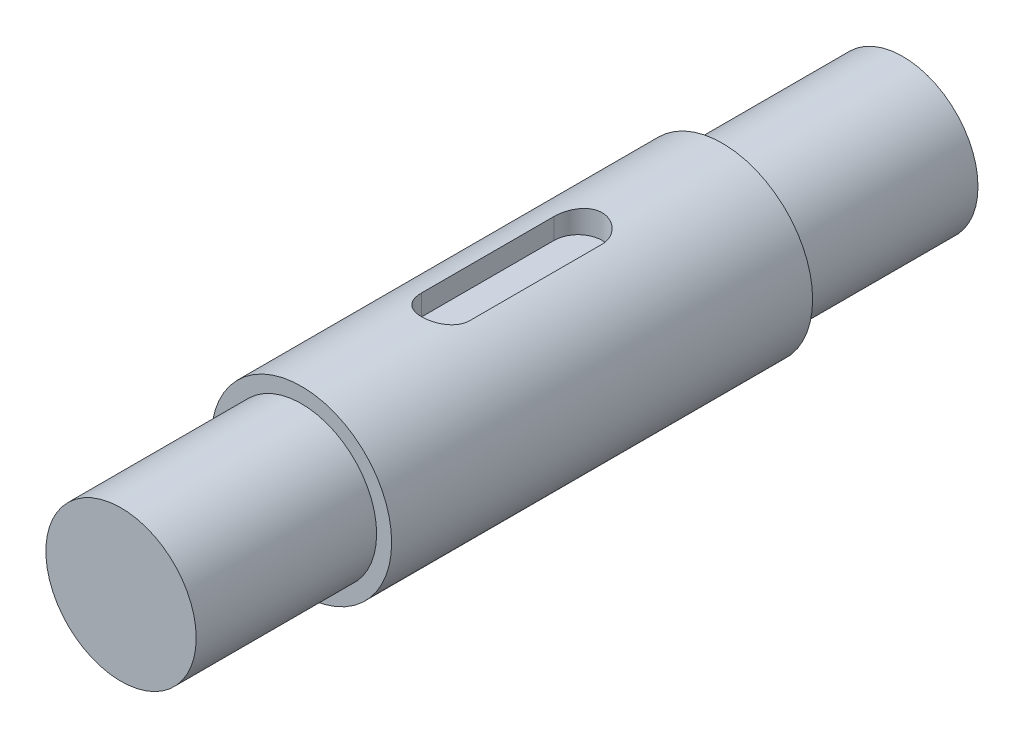
from build123d import *

# Parameters (mm, degrees)
CUT_EXTRUDE1_START = 11
CUT_EXTRUDE1_DEPTH = 92.225241501


with BuildPart() as part:
    # Sketch1 → Revolve1 (revolve)
    with BuildSketch(Plane(origin=(0, 0, 0), x_dir=(0, 0, -1), z_dir=(1, 0, 0)), mode=Mode.PRIVATE) as revolve1_sk:
        Polygon((0, 15), (70, 15), (70, 12.5), (100, 12.5), (100, 0), (-30, 0), (-30, 12.5), (0, 12.5), align=None)
    revolve(revolve1_sk.sketch.rotate(Axis((0, 0, 91.723358082), (0, 0, -1)), 90), axis=Axis((0, 0, 91.723358082), (0, 0, -1)))

    # Sketch2 → Cut-Extrude1 (cut, through all)
    with BuildSketch(Plane(origin=(0, 0, 0), x_dir=(1, 0, 0), z_dir=(0, 1, 0)).offset(CUT_EXTRUDE1_START)):
        with BuildLine():
            Line((4, 46), (4, 24))
            ThreePointArc((4, 24), (0, 20), (-4, 24))
            Line((-4, 24), (-4, 46))
            ThreePointArc((-4, 46), (0, 50), (4, 46))
        make_face()
    extrude(amount=CUT_EXTRUDE1_DEPTH, mode=Mode.SUBTRACT)


solid = part.part
